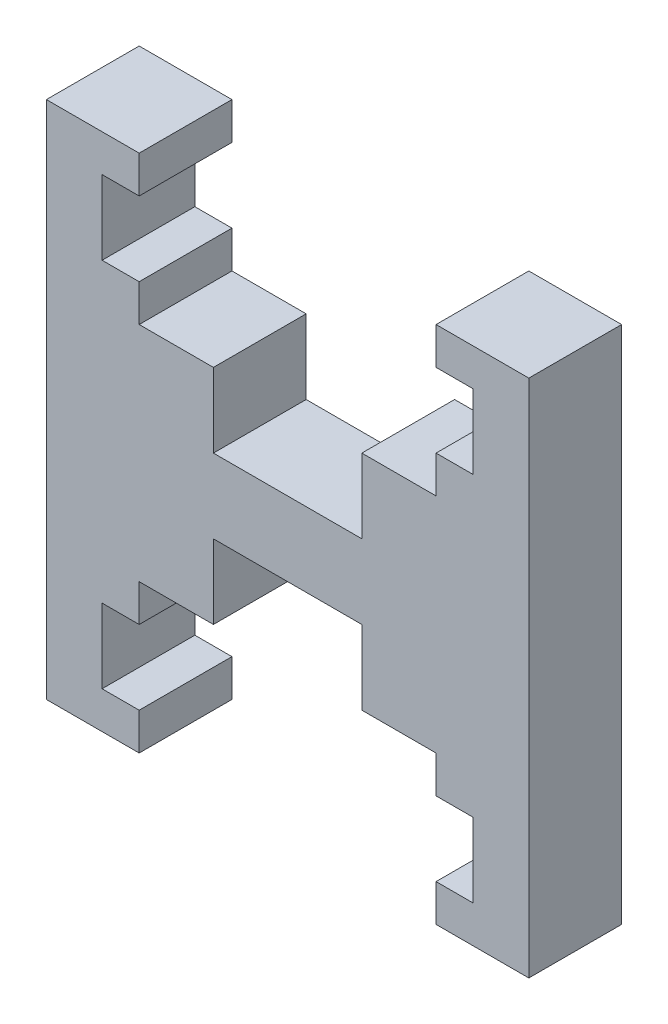
from build123d import *

# Parameters (mm, degrees)
BOSS_EXTRUDE1_DEPTH = 63.5


with BuildPart() as part:
    # Sketch1 → Boss-Extrude1 (new, symmetric)
    with BuildSketch(Plane.XY):
        Polygon((101.6, -50.8), (-101.6, -50.8), (-101.6, -152.4), (-203.2, -152.4), (-203.2, -203.2), (-254, -203.2), (-254, -304.8), (-203.2, -304.8), (-203.2, -355.6), (-330.2, -355.6), (-330.2, 355.6), (-203.2, 355.6), (-203.2, 304.8), (-254, 304.8), (-254, 203.2), (-203.2, 203.2), (-203.2, 152.4), (-101.6, 152.4), (-101.6, 50.8), (101.6, 50.8), (101.6, 152.4), (203.2, 152.4), (203.2, 203.2), (254, 203.2), (254, 304.8), (203.2, 304.8), (203.2, 355.6), (330.2, 355.6), (330.2, -355.6), (203.2, -355.6), (203.2, -304.8), (254, -304.8), (254, -203.2), (203.2, -203.2), (203.2, -152.4), (101.6, -152.4), align=None)
    extrude(amount=BOSS_EXTRUDE1_DEPTH, both=True)


solid = part.part
